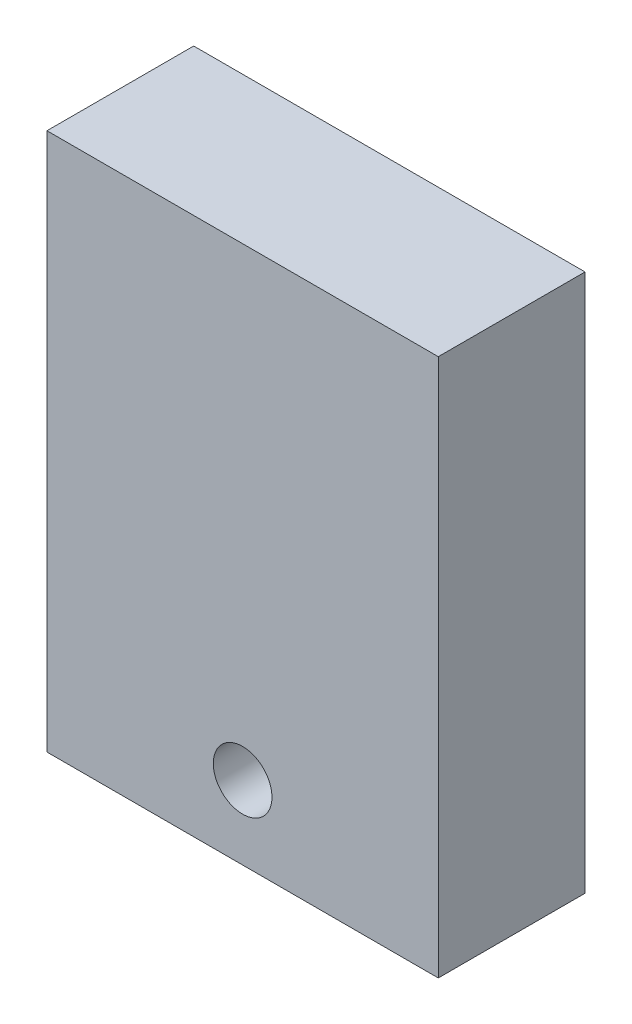
from build123d import *

# Parameters (mm, degrees)
SKETCH_1_W          = 8
SKETCH_1_H          = 3
EXTRUDE_1_DEPTH     = 3
SKETCH_2_W          = 8
SKETCH_2_H          = 8
EXTRUDE_2_DEPTH     = 3
SKETCH_2_3_R        = 2.6
CUT_EXTRUDE_1_DEPTH = 0.8
SKETCH_3_R          = 0.6
CUT_EXTRUDE_2_DEPTH = 13.083045974
SKETCH_3_3_R        = 1
CUT_EXTRUDE_3_DEPTH = 1.5


with BuildPart() as part:
    # 草图1 → 凸台-拉伸1 (new body)
    with BuildSketch(Plane(origin=(0, 0, 0), x_dir=(1, 0, 0), z_dir=(0, 1, 0))):
        Rectangle(SKETCH_1_W, SKETCH_1_H)
    extrude(amount=EXTRUDE_1_DEPTH)

    # 草图2 → 凸台-拉伸2 (add)
    with BuildSketch(Plane(origin=(0, 0, -1.5), x_dir=(-1, 0, 0), z_dir=(0, 0, -1))):
        with Locations((0, 7)):
            Rectangle(SKETCH_2_W, SKETCH_2_H)
    extrude(amount=-EXTRUDE_2_DEPTH)

    # 草图2<3> → 切除-拉伸1 (cut)
    with BuildSketch(Plane(origin=(0, 0, -1.5), x_dir=(-1, 0, 0), z_dir=(0, 0, -1))):
        with Locations((0, 7)):
            Circle(SKETCH_2_3_R)
    extrude(amount=-CUT_EXTRUDE_1_DEPTH, mode=Mode.SUBTRACT)

    # 草图3 → 切除-拉伸2 (cut, through all)
    with BuildSketch(Plane(origin=(0, 0, -1.5), x_dir=(-1, 0, 0), z_dir=(0, 0, -1))):
        with Locations((0, 1.5)):
            Circle(SKETCH_3_R)
    extrude(amount=-CUT_EXTRUDE_2_DEPTH, mode=Mode.SUBTRACT)

    # 草图3<3> → 切除-拉伸3 (cut)
    with BuildSketch(Plane(origin=(0, 0, -1.5), x_dir=(-1, 0, 0), z_dir=(0, 0, -1))):
        with Locations((0, 1.5)):
            Circle(SKETCH_3_3_R)
    extrude(amount=-CUT_EXTRUDE_3_DEPTH, mode=Mode.SUBTRACT)


solid = part.part
